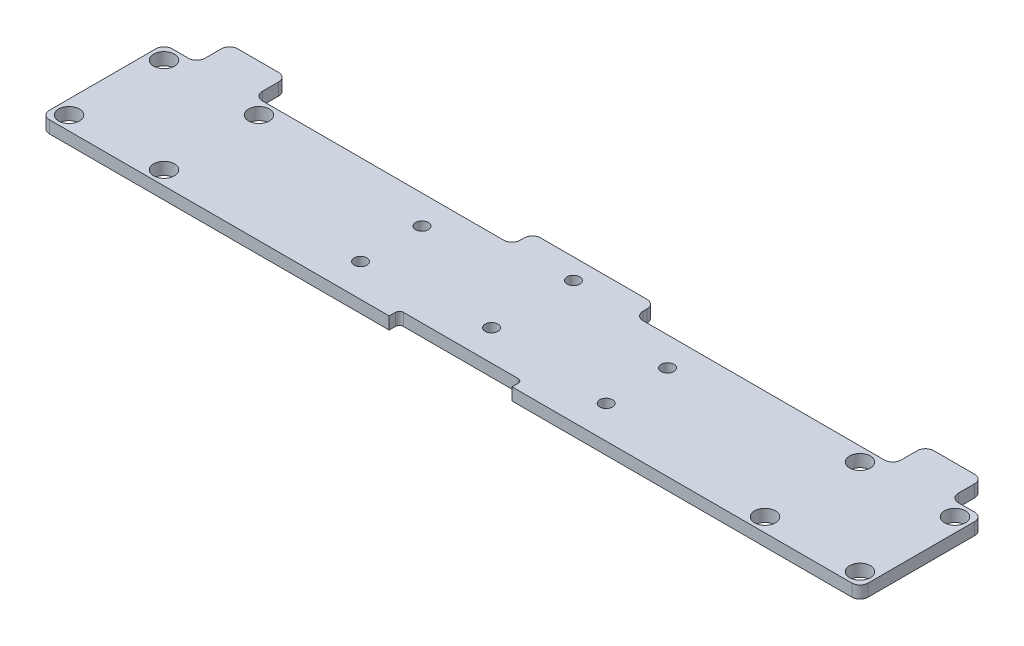
from build123d import *

# Parameters (mm, degrees)
CROQUIS1_R              = 2.55
CROQUIS1_R_2            = 1.55
SALIENTE_EXTRUIR1_DEPTH = 3
REDONDEO2_R             = 2
CORTAR_EXTRUIR1_DEPTH   = 3


with BuildPart() as part:
    # Croquis1 → Saliente-Extruir1 (new body)
    with BuildSketch(Plane(origin=(0, 0, 0), x_dir=(1, 0, 0), z_dir=(0, 1, 0))):
        Polygon((0, 0), (200, 0), (200, 30), (192, 30), (192, 38), (178, 38), (178, 30), (115, 30), (115, 35), (85, 35), (85, 30), (22, 30), (22, 38), (8, 38), (8, 30), (0, 30), align=None)
        with Locations(Location((3.4, 26.6, 0), (0, 0, 270))):
            Circle(CROQUIS1_R, mode=Mode.SUBTRACT)
        with Locations(Location((26.6, 26.6, 0), (0, 0, 270))):
            Circle(CROQUIS1_R, mode=Mode.SUBTRACT)
        with Locations(Location((26.6, 3.4, 0), (0, 0, 270))):
            Circle(CROQUIS1_R, mode=Mode.SUBTRACT)
        with Locations(Location((3.4, 3.4, 0), (0, 0, 270))):
            Circle(CROQUIS1_R, mode=Mode.SUBTRACT)
        with Locations(Location((173.4, 3.4, 0), (0, 0, 90))):
            Circle(CROQUIS1_R, mode=Mode.SUBTRACT)
        with Locations(Location((196.6, 3.4, 0), (0, 0, 90))):
            Circle(CROQUIS1_R, mode=Mode.SUBTRACT)
        with Locations(Location((196.6, 26.6, 0), (0, 0, 90))):
            Circle(CROQUIS1_R, mode=Mode.SUBTRACT)
        with Locations(Location((173.4, 26.6, 0), (0, 0, 90))):
            Circle(CROQUIS1_R, mode=Mode.SUBTRACT)
        with Locations(Location((100, 30, 0), (0, 0, 270))):
            Circle(CROQUIS1_R_2, mode=Mode.SUBTRACT)
        with Locations(Location((100, 10, 0), (0, 0, 270))):
            Circle(CROQUIS1_R_2, mode=Mode.SUBTRACT)
        with Locations(Location((70, 23, 0), (0, 0, 270))):
            Circle(CROQUIS1_R_2, mode=Mode.SUBTRACT)
        with Locations(Location((70, 8, 0), (0, 0, 270))):
            Circle(CROQUIS1_R_2, mode=Mode.SUBTRACT)
        with Locations(Location((130, 8, 0), (0, 0, 90))):
            Circle(CROQUIS1_R_2, mode=Mode.SUBTRACT)
        with Locations(Location((130, 23, 0), (0, 0, 90))):
            Circle(CROQUIS1_R_2, mode=Mode.SUBTRACT)
    extrude(amount=SALIENTE_EXTRUIR1_DEPTH)

    # Redondeo2
    redondeo2_edges = [part.edges().sort_by_distance(p)[0] for p in [
        (0, 1.5, -30),
        (8, 1.5, -30),
        (8, 1.5, -38),
        (22, 1.5, -38),
        (22, 1.5, -30),
        (85, 1.5, -30),
        (85, 1.5, -35),
        (115, 1.5, -35),
        (115, 1.5, -30),
        (178, 1.5, -30),
        (178, 1.5, -38),
        (192, 1.5, -38),
        (192, 1.5, -30),
        (200, 1.5, -30),
        (200, 1.5, 0),
        (0, 1.5, 0),
    ]]
    fillet(redondeo2_edges, radius=REDONDEO2_R)

    # Croquis2 → Cortar-Extruir1 (cut)
    with BuildSketch(Plane(origin=(0, 3, 0), x_dir=(1, 0, 0), z_dir=(0, 1, 0))):
        with BuildLine():
            Line((85, 0), (115, 0))
            Line((115, 0), (115, 1.5))
            ThreePointArc((115, 1.5), (114.707106781, 2.207106781), (114, 2.5))
            Line((114, 2.5), (86, 2.5))
            ThreePointArc((86, 2.5), (85.292893219, 2.207106781), (85, 1.5))
            Line((85, 1.5), (85, 0))
        make_face()
    extrude(amount=-CORTAR_EXTRUIR1_DEPTH, mode=Mode.SUBTRACT)


solid = part.part
